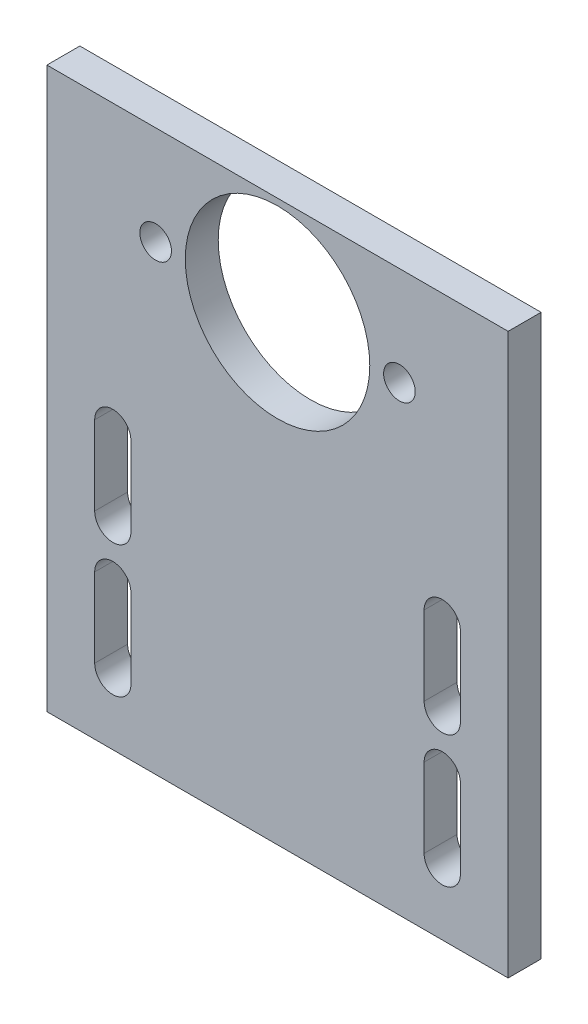
from build123d import *

# Parameters (mm, degrees)
SKETCH1_R           = 2.4
SKETCH1_R_2         = 14
BOSS_EXTRUDE1_DEPTH = 5


with BuildPart() as part:
    # Sketch1 → Boss-Extrude1 (new body)
    with BuildSketch(Plane.XY):
        Polygon((-35, 50), (-35, -15), (-35, -35), (35, -35), (35, -15), (35, 50), align=None)
        with BuildLine():
            ThreePointArc((-22.25, -25), (-25, -27.75), (-27.75, -25))
            Line((-27.75, -25), (-27.75, -13))
            ThreePointArc((-27.75, -13), (-25, -10.25), (-22.25, -13))
            Line((-22.25, -13), (-22.25, -25))
        make_face(mode=Mode.SUBTRACT)
        with BuildLine():
            ThreePointArc((-22.25, -5), (-25, -7.75), (-27.75, -5))
            Line((-27.75, -5), (-27.75, 7))
            ThreePointArc((-27.75, 7), (-25, 9.75), (-22.25, 7))
            Line((-22.25, 7), (-22.25, -5))
        make_face(mode=Mode.SUBTRACT)
        with BuildLine():
            Line((27.75, -13), (27.75, -25))
            ThreePointArc((27.75, -25), (25, -27.75), (22.25, -25))
            Line((22.25, -25), (22.25, -13))
            ThreePointArc((22.25, -13), (25, -10.25), (27.75, -13))
        make_face(mode=Mode.SUBTRACT)
        with BuildLine():
            Line((27.75, 7), (27.75, -5))
            ThreePointArc((27.75, -5), (25, -7.75), (22.25, -5))
            Line((22.25, -5), (22.25, 7))
            ThreePointArc((22.25, 7), (25, 9.75), (27.75, 7))
        make_face(mode=Mode.SUBTRACT)
        with Locations((-18.5, 35)):
            Circle(SKETCH1_R, mode=Mode.SUBTRACT)
        with Locations((0, 35)):
            Circle(SKETCH1_R_2, mode=Mode.SUBTRACT)
        with Locations((18.5, 35)):
            Circle(SKETCH1_R, mode=Mode.SUBTRACT)
    extrude(amount=BOSS_EXTRUDE1_DEPTH)


solid = part.part
